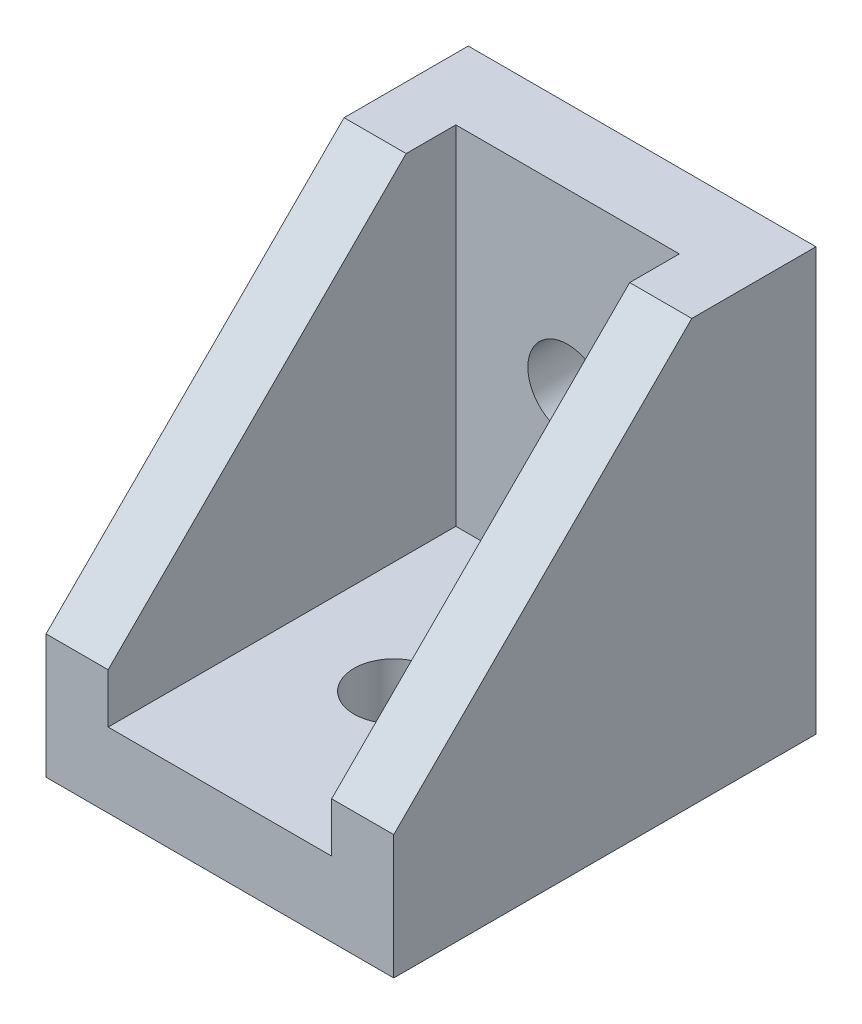
from build123d import *

# Parameters (mm, degrees)
SKETCH1_W           = 14
SKETCH1_H           = 14
SKETCH1_R           = 1.6
BOSS_EXTRUDE1_DEPTH = 3
SKETCH2_R           = 1.6
BOSS_EXTRUDE2_DEPTH = 3
BOSS_EXTRUDE3_START = -4.5
BOSS_EXTRUDE3_DEPTH = 2.5


with BuildPart() as part:
    # Sketch1 → Boss-Extrude1 (new body)
    with BuildSketch(Plane(origin=(0, 0, 0), x_dir=(1, 0, 0), z_dir=(0, 1, 0))):
        Rectangle(SKETCH1_W, SKETCH1_H)
        with Locations(Location((0, 0, 0), (0, 0, 270))):
            Circle(SKETCH1_R, mode=Mode.SUBTRACT)
    extrude(amount=BOSS_EXTRUDE1_DEPTH)

    # Sketch2 → Boss-Extrude2 (add)
    with BuildSketch(Plane(origin=(0, 0, -7), x_dir=(-1, 0, 0), z_dir=(0, 0, -1))):
        Polygon((-7, 3), (-7, 0), (7, 0), (7, 3), (7, 17), (-7, 17), align=None)
        with Locations((0, 10)):
            Circle(SKETCH2_R, mode=Mode.SUBTRACT)
    extrude(amount=BOSS_EXTRUDE2_DEPTH)

    # Sketch5 → Boss-Extrude3 (add)
    with BuildSketch(Plane(origin=(0, 0, 0), x_dir=(0, 0, -1), z_dir=(1, 0, 0)).offset(BOSS_EXTRUDE3_START)):
        Polygon((7, 17), (5, 17), (-7, 5), (-7, 3), (7, 3), align=None)
    boss_extrude3 = extrude(amount=-BOSS_EXTRUDE3_DEPTH)

    # Mirror2: Boss-Extrude3 across plane
    add(boss_extrude3.mirror(Plane(origin=(0, 0, 0), x_dir=(0, 0, 1), z_dir=(1, 0, 0))))


solid = part.part
